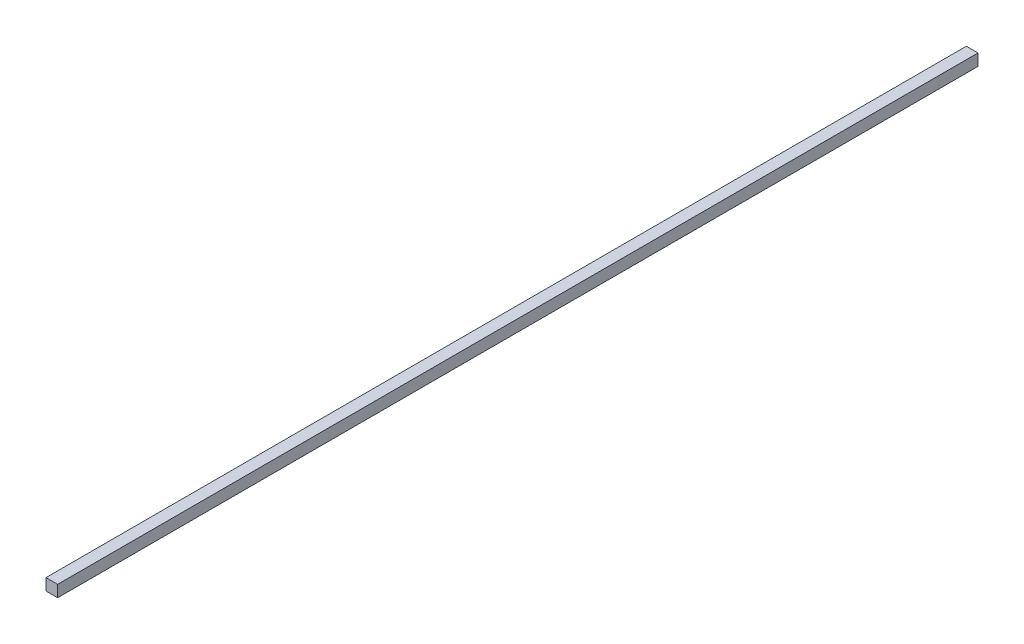
from build123d import *

# Parameters (mm, degrees)
SKETCH2_W           = 10
SKETCH2_H           = 10
BOSS_EXTRUDE1_DEPTH = 790


with BuildPart() as part:
    # Sketch2 → Boss-Extrude1 (new body)
    with BuildSketch(Plane.XY):
        with Locations((-1.534653465, -0.940594059)):
            Rectangle(SKETCH2_W, SKETCH2_H)
    extrude(amount=BOSS_EXTRUDE1_DEPTH)


solid = part.part
